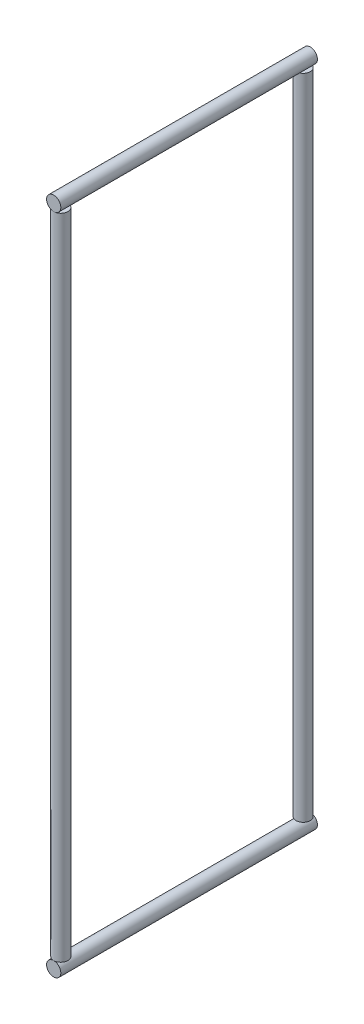
from build123d import *

# Parameters (mm, degrees)
SKETCH1_R           = 3.175
BOSS_EXTRUDE1_DEPTH = 114.3
SKETCH3_R           = 3.175
BOSS_EXTRUDE3_DEPTH = 288.925
SKETCH4_R           = 3.175
BOSS_EXTRUDE4_DEPTH = 288.925
SKETCH5_R           = 3.175
BOSS_EXTRUDE5_DEPTH = 114.3


with BuildPart() as part:
    # Sketch1 → Boss-Extrude1 (new body)
    with BuildSketch(Plane.XY):
        Circle(SKETCH1_R)
    extrude(amount=BOSS_EXTRUDE1_DEPTH)


with BuildPart() as body_2:
    # Sketch3 → Boss-Extrude3 (new body)
    with BuildSketch(Plane(origin=(0, 3.175, 0), x_dir=(1, 0, 0), z_dir=(0, 1, 0))):
        with Locations(Location((0, -111.125, 0), (0, 0, 270))):
            Circle(SKETCH3_R)
    extrude(amount=BOSS_EXTRUDE3_DEPTH)


with BuildPart() as body_3:
    # Sketch4 → Boss-Extrude4 (new body)
    with BuildSketch(Plane(origin=(0, 3.175, 0), x_dir=(1, 0, 0), z_dir=(0, 1, 0))):
        with Locations(Location((0, -3.175, 0), (0, 0, 270))):
            Circle(SKETCH4_R)
    extrude(amount=BOSS_EXTRUDE4_DEPTH)


with BuildPart() as body_4:
    # Sketch5 → Boss-Extrude5 (new body)
    with BuildSketch(Plane.XY):
        with Locations((0, 295.275)):
            Circle(SKETCH5_R)
    extrude(amount=BOSS_EXTRUDE5_DEPTH)


solid = Compound([part.part, body_2.part, body_3.part, body_4.part])
